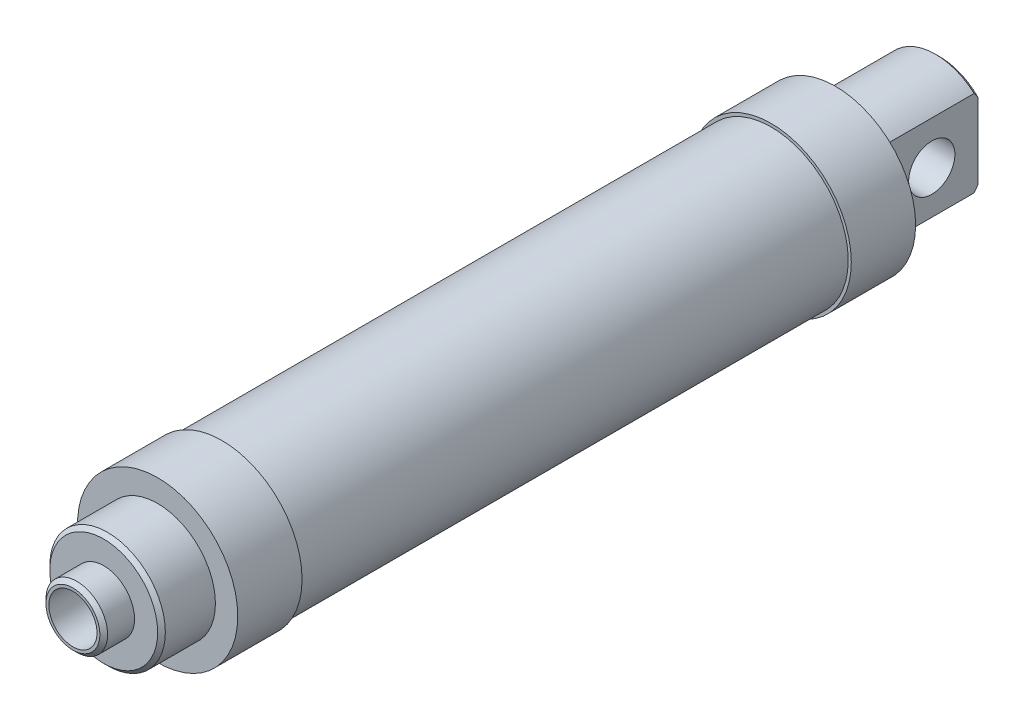
from build123d import *

# Parameters (mm, degrees)
ESQUISSE1_R             = 20
BOSS_EXTRU_1_DEPTH      = 142.6
ESQUISSE2_R             = 20.8
BOSS_EXTRU_2_DEPTH      = 16.7
BOSS_EXTRU_5_START      = -159.3
ESQUISSE2_3_R           = 20.8
BOSS_EXTRU_5_DEPTH      = 16.7
ESQUISSE3_R             = 15
BOSS_EXTRU_6_DEPTH      = 27
ESQUISSE4_W             = 6
ESQUISSE4_H             = 30
ENL_V_MAT_EXTRU_1_DEPTH = 26
ESQUISSE5_R             = 6
ENL_V_MAT_EXTRU_2_DEPTH = 164.578024196
CHANFREIN1_SIZE         = 1
BOSS_EXTRU_7_START      = 14
ESQUISSE6_R             = 15
BOSS_EXTRU_7_DEPTH      = 14
ESQUISSE7_R             = 8
BOSS_EXTRU_8_DEPTH      = 8
CHANFREIN3_SIZE         = 1
ESQUISSE9_R             = 6.25
ENL_V_MAT_EXTRU_3_DEPTH = 100


with BuildPart() as part:
    # Esquisse1 → Boss.-Extru.1 (new body)
    with BuildSketch(Plane.XY):
        Circle(ESQUISSE1_R)
    extrude(amount=BOSS_EXTRU_1_DEPTH)

    # Esquisse2 → Boss.-Extru.2 (add)
    with BuildSketch(Plane.XY.offset(142.6)):
        Circle(ESQUISSE2_R)
    extrude(amount=BOSS_EXTRU_2_DEPTH)

    # Esquisse2<3> → Boss.-Extru.5 (add)
    with BuildSketch(Plane.XY.offset(142.6).offset(BOSS_EXTRU_5_START)):
        Circle(ESQUISSE2_3_R)
    extrude(amount=BOSS_EXTRU_5_DEPTH)

    # Esquisse3 → Boss.-Extru.6 (add)
    with BuildSketch(Plane(origin=(0, 0, -16.7), x_dir=(-1, 0, 0), z_dir=(0, 0, -1))):
        Circle(ESQUISSE3_R)
    extrude(amount=BOSS_EXTRU_6_DEPTH)

    # Esquisse4 → Enlèv. mat.-Extru.1 (cut)
    with BuildSketch(Plane(origin=(0, 0, -43.7), x_dir=(-1, 0, 0), z_dir=(0, 0, -1))):
        with Locations((-13, 0)):
            Rectangle(ESQUISSE4_W, ESQUISSE4_H)
        with Locations((13, 0)):
            Rectangle(ESQUISSE4_W, ESQUISSE4_H)
    extrude(amount=-ENL_V_MAT_EXTRU_1_DEPTH, mode=Mode.SUBTRACT)

    # Esquisse5 → Enlèv. mat.-Extru.2 (cut, through all)
    with BuildSketch(Plane(origin=(10, 0, 0), x_dir=(0, 0, -1), z_dir=(1, 0, 0))):
        with Locations((31.7, 0)):
            Circle(ESQUISSE5_R)
    extrude(amount=-ENL_V_MAT_EXTRU_2_DEPTH, mode=Mode.SUBTRACT)

    # Chanfrein1
    chanfrein1_edges = [part.edges().sort_by_distance(p)[0] for p in [
        (0, 15, -43.7),
        (0, -15, -43.7),
    ]]
    chamfer(chanfrein1_edges, length=CHANFREIN1_SIZE)

    # Esquisse6 → Boss.-Extru.7 (add)
    with BuildSketch(Plane.XY.offset(159.3).offset(BOSS_EXTRU_7_START)):
        Circle(ESQUISSE6_R)
    extrude(amount=-BOSS_EXTRU_7_DEPTH)

    # Esquisse7 → Boss.-Extru.8 (add)
    with BuildSketch(Plane.XY.offset(173.3)):
        Circle(ESQUISSE7_R)
    extrude(amount=BOSS_EXTRU_8_DEPTH)

    # Chanfrein3
    chanfrein3_edges = [part.edges().sort_by_distance(p)[0] for p in [
        (-8, 0, 181.3),
        (-15, 0, 173.3),
    ]]
    chamfer(chanfrein3_edges, length=CHANFREIN3_SIZE)

    # Esquisse9 → Enlèv. mat.-Extru.3 (cut)
    with BuildSketch(Plane.XY.offset(181.3)):
        Circle(ESQUISSE9_R)
    extrude(amount=-ENL_V_MAT_EXTRU_3_DEPTH, mode=Mode.SUBTRACT)


solid = part.part
